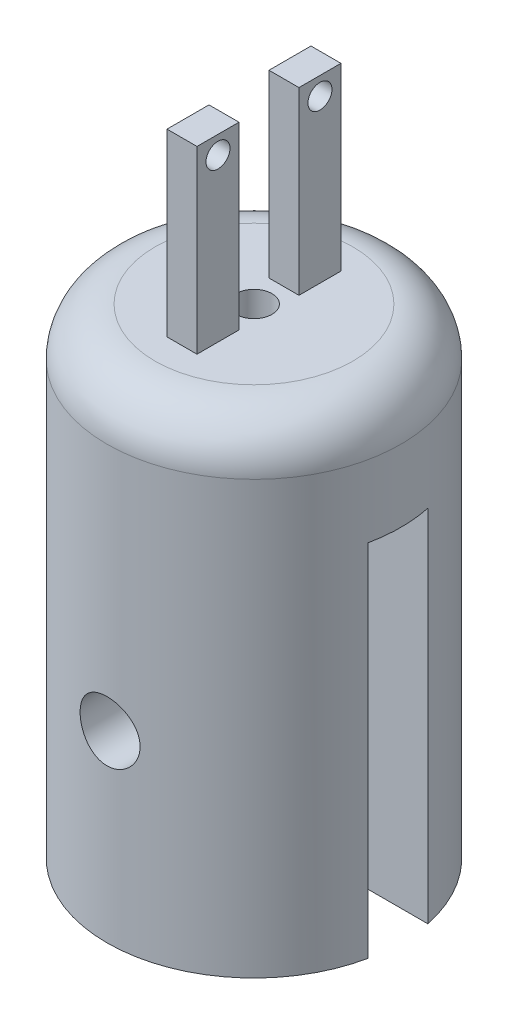
from build123d import *

# Parameters (mm, degrees)
SKETCH1_R               = 24.5
BOSS_EXTRUDE1_DEPTH     = 80
FILLET1_R               = 8
CUT_EXTRUDE1_DEPTH      = 88.180846548
CUT_EXTRUDE1_DEPTH_BACK = 88.180846548
SKETCH2_R               = 5
SKETCH3_W               = 56.031714123
SKETCH3_H               = 10
CUT_EXTRUDE2_DEPTH      = 60
SKETCH4_R               = 3
CUT_EXTRUDE3_DEPTH      = 60
SKETCH5_W               = 5
SKETCH5_H               = 7
BOSS_EXTRUDE2_DEPTH     = 30
SKETCH6_R               = 2
CUT_EXTRUDE4_DEPTH      = 116.884640959


with BuildPart() as part:
    # Sketch1 → Boss-Extrude1 (new body)
    with BuildSketch(Plane(origin=(0, 0, 0), x_dir=(1, 0, 0), z_dir=(0, 1, 0))):
        with Locations(Location((0, 0, 0), (0, 0, 270))):
            Circle(SKETCH1_R)
    extrude(amount=BOSS_EXTRUDE1_DEPTH)

    # Fillet1
    fillet1_edges = [part.edges().sort_by_distance(p)[0] for p in [
        (0, 80, -24.5),
    ]]
    fillet(fillet1_edges, radius=FILLET1_R)

    # Sketch2 → Cut-Extrude1 (cut, two sides: drawn at the far end of the back side and taken through both)
    with BuildSketch(Plane.XY.offset(-CUT_EXTRUDE1_DEPTH_BACK)):
        with Locations((0, 30.57)):
            Circle(SKETCH2_R)
    extrude(amount=CUT_EXTRUDE1_DEPTH + CUT_EXTRUDE1_DEPTH_BACK, mode=Mode.SUBTRACT)

    # Sketch3 → Cut-Extrude2 (cut)
    with BuildSketch(Plane(origin=(0, 0, 0), x_dir=(1, 0, 0), z_dir=(0, 1, 0))):
        with Locations((-1.359495315, 0)):
            Rectangle(SKETCH3_W, SKETCH3_H)
    extrude(amount=CUT_EXTRUDE2_DEPTH, mode=Mode.SUBTRACT)

    # Sketch4 → Cut-Extrude3 (cut)
    with BuildSketch(Plane(origin=(0, 80, 0), x_dir=(1, 0, 0), z_dir=(0, 1, 0))):
        with Locations(Location((0, 0, 0), (0, 0, 270))):
            Circle(SKETCH4_R)
    extrude(amount=-CUT_EXTRUDE3_DEPTH, mode=Mode.SUBTRACT)

    # Sketch5 → Boss-Extrude2 (add)
    with BuildSketch(Plane(origin=(0, 80, 0), x_dir=(1, 0, 0), z_dir=(0, 1, 0))):
        with Locations((0, 8.5)):
            Rectangle(SKETCH5_W, SKETCH5_H)
    boss_extrude2 = extrude(amount=BOSS_EXTRUDE2_DEPTH)

    # Sketch6 → Cut-Extrude4 (cut, through all)
    with BuildSketch(Plane.ZY.offset(2.5)):
        with Locations((-8.5, 107)):
            Circle(SKETCH6_R)
    cut_extrude4 = extrude(amount=-CUT_EXTRUDE4_DEPTH, mode=Mode.SUBTRACT)

    # Mirror1: Boss-Extrude2, Cut-Extrude4 across plane
    add(boss_extrude2.mirror(Plane.XY))
    add(cut_extrude4.mirror(Plane.XY), mode=Mode.SUBTRACT)


solid = part.part
